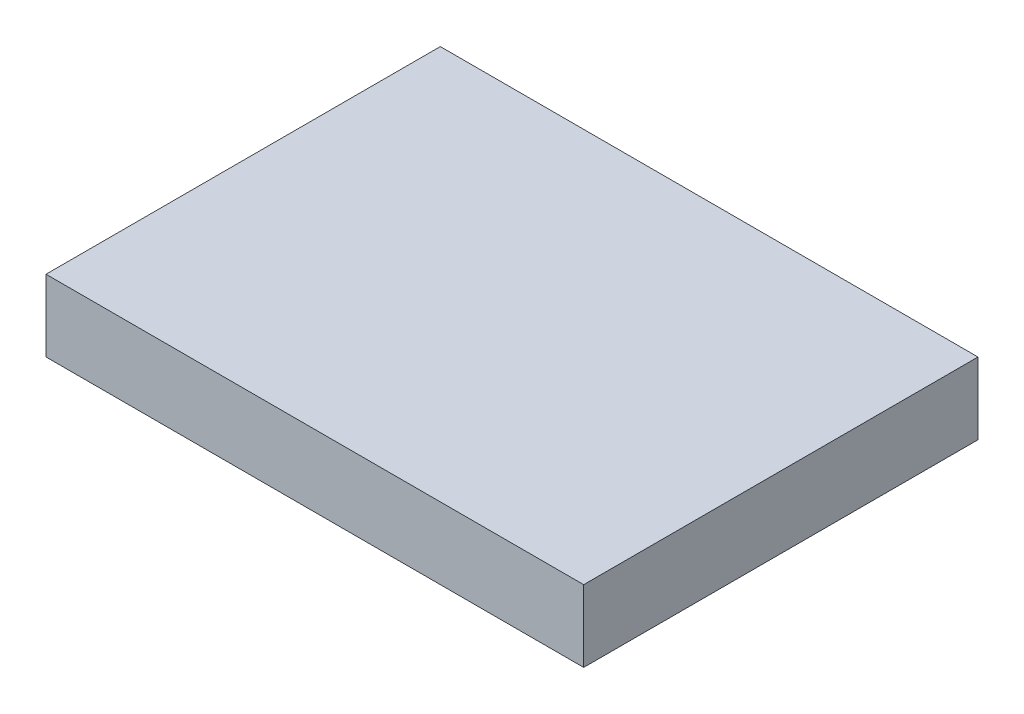
from build123d import *

# Parameters (mm, degrees)
SKETCH1_W           = 75
SKETCH1_H           = 55
BOSS_EXTRUDE1_DEPTH = 10


with BuildPart() as part:
    # Sketch1 → Boss-Extrude1 (new body)
    with BuildSketch(Plane(origin=(0, 0, 0), x_dir=(1, 0, 0), z_dir=(0, 1, 0))):
        Rectangle(SKETCH1_W, SKETCH1_H)
    extrude(amount=BOSS_EXTRUDE1_DEPTH)


solid = part.part
